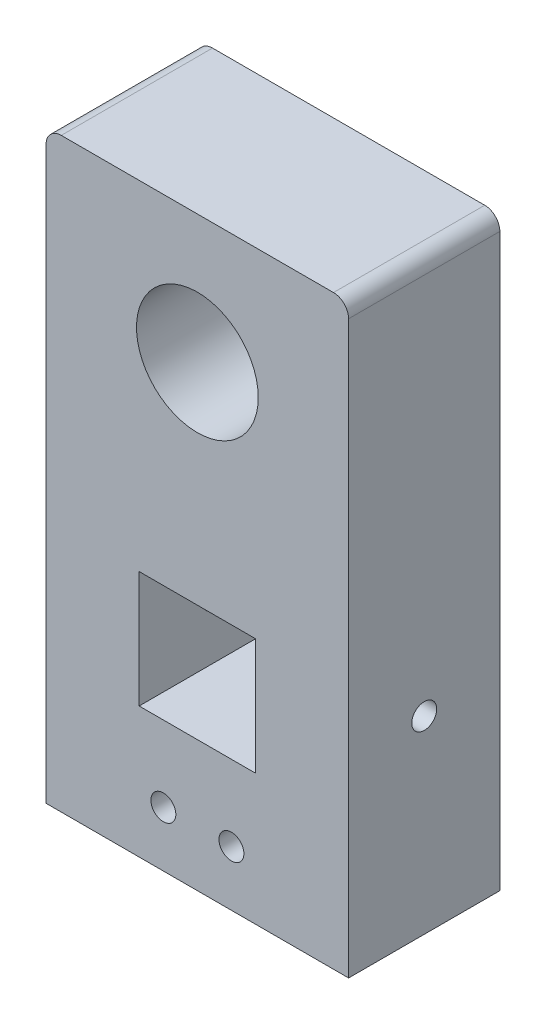
from build123d import *

# Parameters (mm, degrees)
SKETCH_1_W          = 40
SKETCH_1_H          = 55
EXTRUDE_1_DEPTH     = 20
SKETCH_2_R          = 8.05
CUT_EXTRUDE_1_DEPTH = 20
SKETCH_3_W          = 40
SKETCH_3_H          = 20
EXTRUDE_2_DEPTH     = 32.5
SKETCH_6_W          = 15.4
SKETCH_6_H          = 15.4
CUT_EXTRUDE_4_DEPTH = 1000
SKETCH_4_R          = 1.65
CUT_EXTRUDE_2_DEPTH = 40
SKETCH_5_W          = 5
SKETCH_5_H          = 5
CUT_EXTRUDE_3_DEPTH = 6
FILLET_1_R          = 2
SKETCH_7_W          = 47.564048478
SKETCH_7_H          = 11.463166905
CUT_EXTRUDE_5_DEPTH = 100
SKETCH_8_R          = 1.65
CUT_EXTRUDE_6_DEPTH = 1000


with BuildPart() as part:
    # 草图1 → 凸台-拉伸1 (new body)
    with BuildSketch(Plane.XY):
        Rectangle(SKETCH_1_W, SKETCH_1_H)
    extrude(amount=EXTRUDE_1_DEPTH)

    # 草图2 → 切除-拉伸1 (cut)
    with BuildSketch(Plane.XY.offset(20)):
        with Locations((0, 10.5)):
            Circle(SKETCH_2_R)
    extrude(amount=-CUT_EXTRUDE_1_DEPTH, mode=Mode.SUBTRACT)

    # 草图3 → 凸台-拉伸2 (add)
    with BuildSketch(Plane.XZ.offset(27.5)):
        with Locations((0, 10)):
            Rectangle(SKETCH_3_W, SKETCH_3_H)
    extrude(amount=EXTRUDE_2_DEPTH)

    # 草图6 → 切除-拉伸4 (cut)
    with BuildSketch(Plane.XY.offset(20)):
        with Locations((0, -25)):
            Rectangle(SKETCH_6_W, SKETCH_6_H)
    extrude(amount=-CUT_EXTRUDE_4_DEPTH, mode=Mode.SUBTRACT)

    # 草图4 → 切除-拉伸2 (cut)
    with BuildSketch(Plane.XY.offset(20)):
        with Locations((4.5, -42.7)):
            Circle(SKETCH_4_R)
        with Locations((-4.5, -42.7)):
            Circle(SKETCH_4_R)
    extrude(amount=-CUT_EXTRUDE_2_DEPTH, mode=Mode.SUBTRACT)

    # 草图5 → 切除-拉伸3 (cut)
    with BuildSketch(Plane.XZ.offset(60)):
        with Locations((0, 12)):
            Rectangle(SKETCH_5_W, SKETCH_5_H)
    extrude(amount=-CUT_EXTRUDE_3_DEPTH, mode=Mode.SUBTRACT)

    # 圆角1
    fillet_1_edges = [part.edges().sort_by_distance(p)[0] for p in [
        (-20, 27.5, 10),
        (20, 27.5, 10),
    ]]
    fillet(fillet_1_edges, radius=FILLET_1_R)

    # 草图7 → 切除-拉伸5 (cut)
    with BuildSketch(Plane.XY.offset(20)):
        with Locations((0, -55.731583453)):
            Rectangle(SKETCH_7_W, SKETCH_7_H)
    extrude(amount=-CUT_EXTRUDE_5_DEPTH, mode=Mode.SUBTRACT)

    # 草图8 → 切除-拉伸6 (cut)
    with BuildSketch(Plane(origin=(20, 0, 0), x_dir=(0, 0, -1), z_dir=(1, 0, 0))):
        with Locations((-10, -25)):
            Circle(SKETCH_8_R)
    extrude(amount=-CUT_EXTRUDE_6_DEPTH, mode=Mode.SUBTRACT)


solid = part.part
